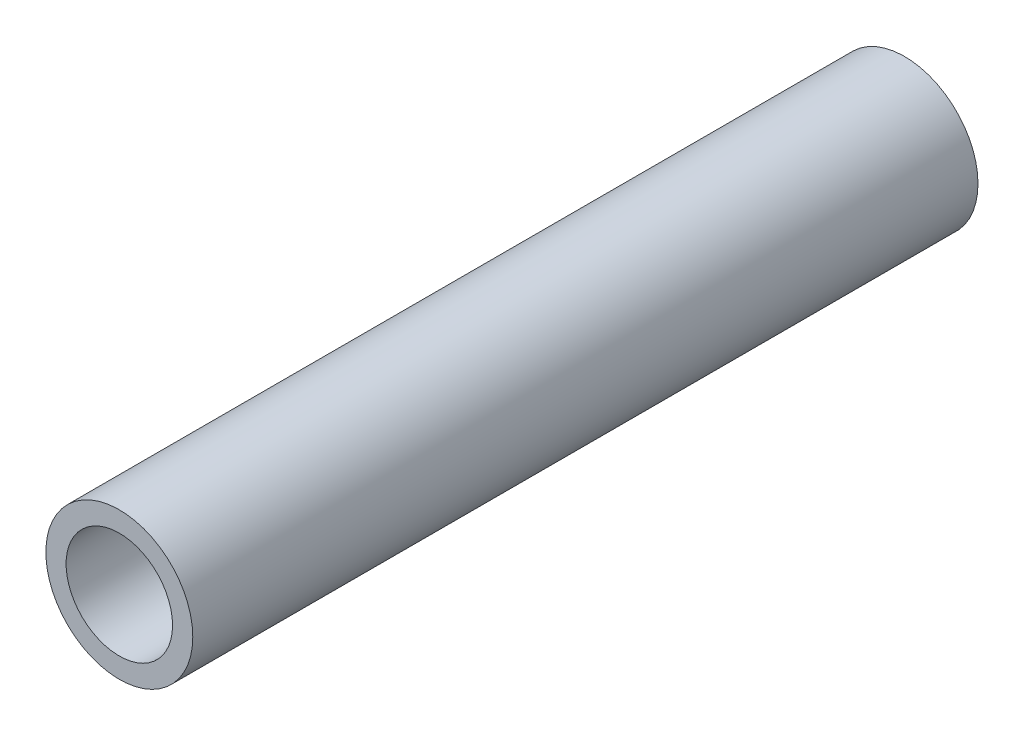
from build123d import *

# Parameters (mm, degrees)
SKETCH1_R           = 10.6934
SKETCH1_R_2         = 7.747
BOSS_EXTRUDE1_DEPTH = 114.3


with BuildPart() as part:
    # Sketch1 → Boss-Extrude1 (new body)
    with BuildSketch(Plane.XY):
        Circle(SKETCH1_R)
        Circle(SKETCH1_R_2, mode=Mode.SUBTRACT)
    extrude(amount=BOSS_EXTRUDE1_DEPTH)


solid = part.part
